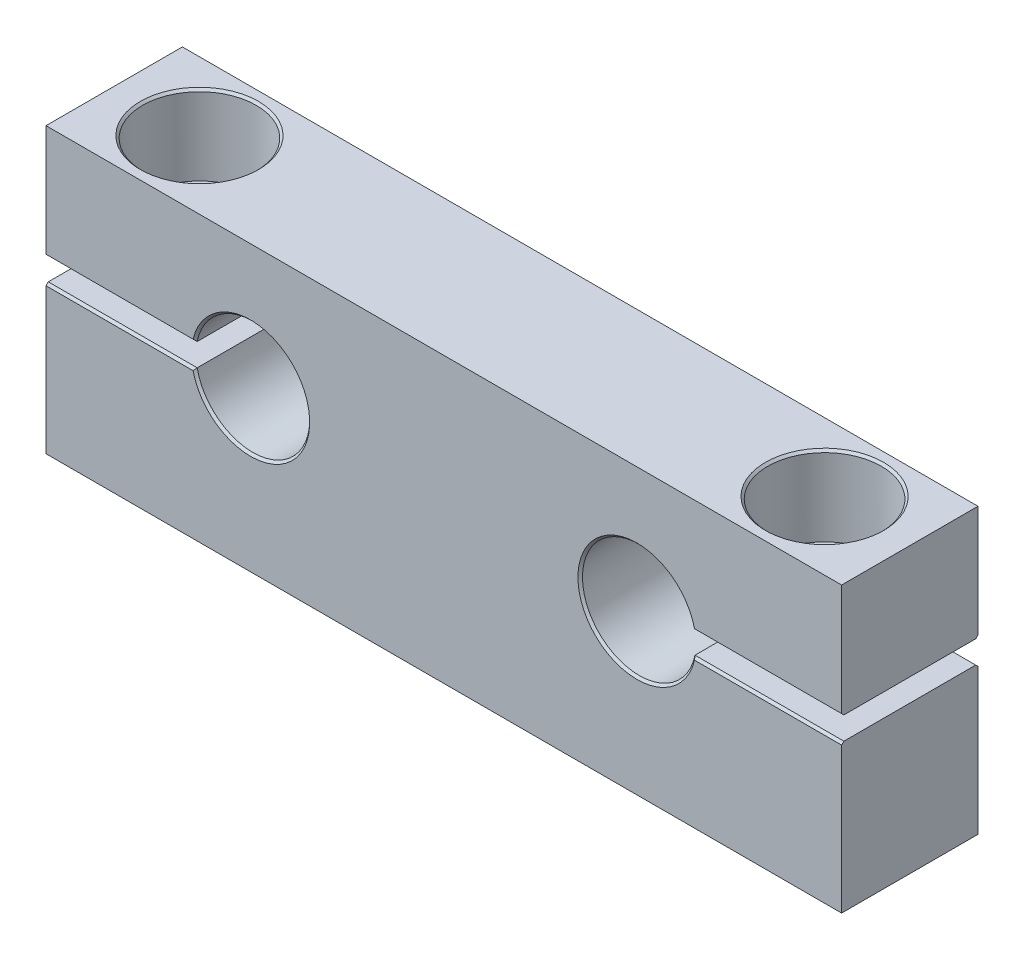
from build123d import *

# Parameters (mm, degrees)
BOSS_EXTRUDE1_DEPTH      = 6
BOSS_EXTRUDE1_DEPTH_BACK = 6
CHAMFER1_SIZE            = 0.2


with BuildPart() as part:
    # Sketch3 → Boss-Extrude1 (new, two sides: drawn at the far end of the back side and taken through both)
    with BuildSketch(Plane.XY.offset(-BOSS_EXTRUDE1_DEPTH_BACK)):
        with BuildLine():
            Line((-35, 12.5), (0, 12.5))
            Line((0, 12.5), (0, -12.5))
            Line((0, -12.5), (-35, -12.5))
            Line((-35, -12.5), (-35, 0.5))
            Line((-35, 0.5), (-21.898979486, 0.5))
            ThreePointArc((-21.898979486, 0.5), (-12, 1.5), (-21.898979486, 2.5))
            Line((-21.898979486, 2.5), (-35, 2.5))
            Line((-35, 2.5), (-35, 12.5))
        make_face()
    extrude(amount=BOSS_EXTRUDE1_DEPTH + BOSS_EXTRUDE1_DEPTH_BACK)

    # Sketch5 → Cut-Revolve1 (revolve, cut)
    with BuildSketch(Plane.XY):
        Polygon((-32.5, 12.5), (-32.5, 5.5), (-30.25, 5.5), (-30.25, -12.5), (-27.5, -12.5), (-27.5, 1.5), (-27.5, 5.5), (-27.5, 12.5), align=None)
    revolve(axis=Axis((-27.5, 12.5, 0), (0, -1, 0)), mode=Mode.SUBTRACT)

    # Chamfer1
    chamfer1_edges = [part.edges().sort_by_distance(p)[0] for p in [
        (-12, 1.5, 6),
        (-28.449489743, 0.5, 6),
        (-28.449489743, 0.5, -6),
        (-12, 1.5, -6),
        (-28.449489743, 2.5, -6),
        (-24.75, -12.5, 0),
        (-22.5, 12.5, 0),
        (-28.449489743, 2.5, 6),
    ]]
    chamfer(chamfer1_edges, length=CHAMFER1_SIZE)

    # Mirror1: part across plane


with BuildPart() as part_1:
    add(part.part)
    add(part.part.mirror(Plane(origin=(0, 0, 0), x_dir=(0, 0, 1), z_dir=(1, 0, 0))))


solid = part_1.part
